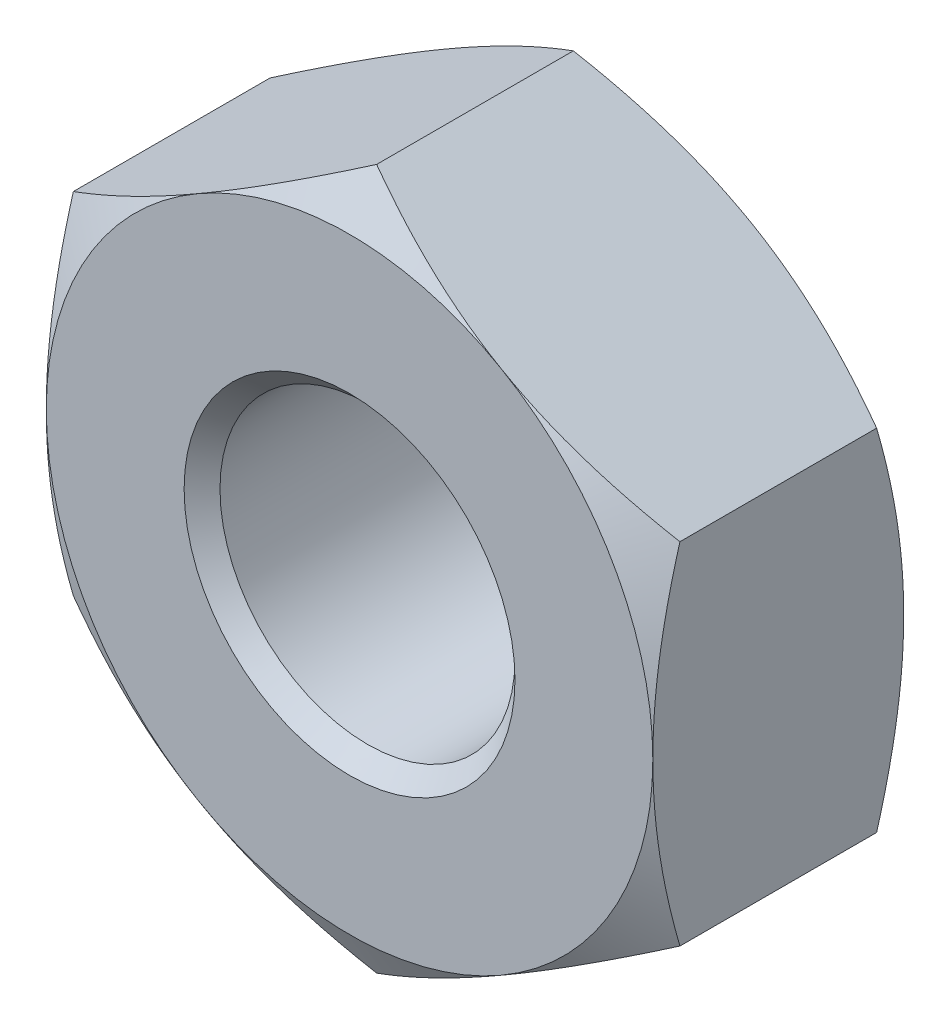
from build123d import *

# Parameters (mm, degrees)
SKETCH1_R           = 1.3375
BOSS_EXTRUDE1_DEPTH = 2.275


with BuildPart() as part:
    # Sketch1 → Boss-Extrude1 (new body)
    with BuildSketch(Plane.XY):
        Polygon((0, 3.175426481), (-2.75, 1.58771324), (-2.75, -1.58771324), (0, -3.175426481), (2.75, -1.58771324), (2.75, 1.58771324), align=None)
        Circle(SKETCH1_R, mode=Mode.SUBTRACT)
    extrude(amount=BOSS_EXTRUDE1_DEPTH)

    # Sketch2 → Cut-Revolve1 (revolve, cut)
    with BuildSketch(Plane(origin=(0, 0, 0), x_dir=(0, 0, -1), z_dir=(1, 0, 0))):
        Polygon((-2.275, 1.3375), (-2.275, 1.5), (-2.1125, 1.3375), align=None)
        Polygon((-2.275, 3.175426481), (-2.275, 2.75), (-2.029379907, 3.175426481), align=None)
        Polygon((-0.245620093, 3.175426481), (0, 3.175426481), (0, 2.75), align=None)
        Polygon((-0.1625, 1.3375), (0, 1.3375), (0, 1.5), align=None)
    revolve(axis=Axis((0, 0, 0), (0, 0, 1)), mode=Mode.SUBTRACT)


solid = part.part
